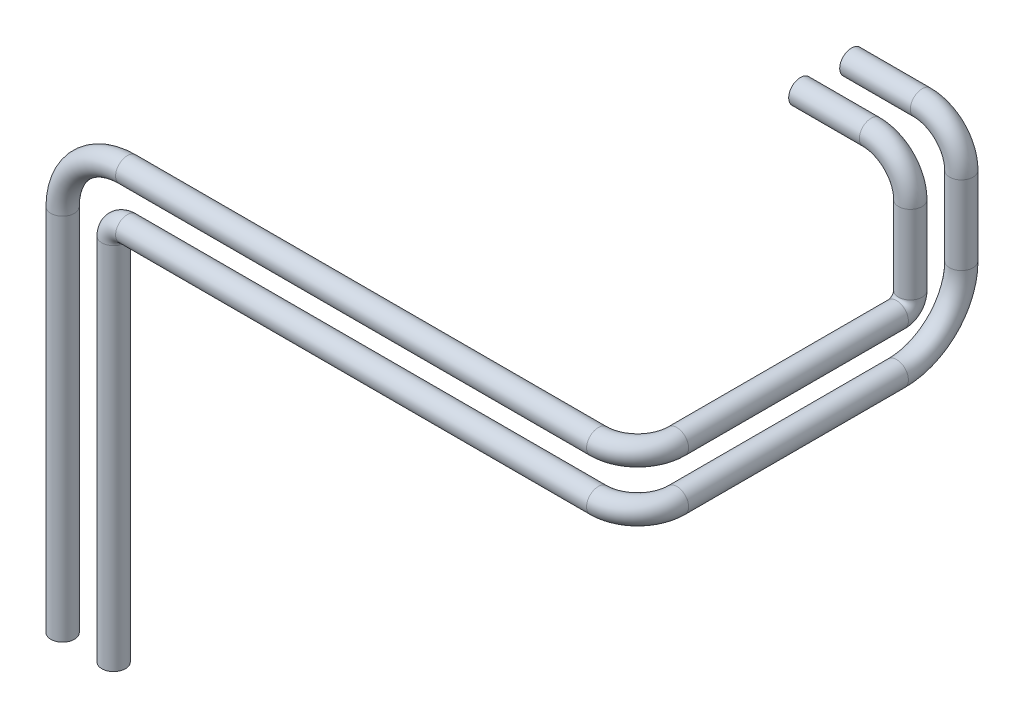
from build123d import *

# Parameters (mm, degrees)
SKETCH5_R = 1.5


with BuildPart() as part:
    # Sweep1: sweep along a curve in space
    with BuildLine() as sweep1_path:
        Line((0, 0, 0), (0, 47, 0))
        ThreePointArc((0, 47, 0), (1.464466094, 50.535533906, 0), (5, 52, 0))
        Line((5, 52, 0), (65, 52, 0))
        ThreePointArc((70, 52, -5), (68.535533906, 52, -1.464466094), (65, 52, 0))
        Line((70, 52, -5), (70, 52, -33))
        ThreePointArc((70, 52, -33), (70, 53.464466094, -36.535533906), (70, 57, -38))
        Line((70, 57, -38), (70, 67, -38))
        ThreePointArc((65, 72, -38), (68.535533906, 70.535533906, -38), (70, 67, -38))
        Line((65, 72, -38), (56, 72, -38))
    # Sketch5 → Sweep1 (sweep)
    with BuildSketch(Plane(origin=(0, 0, 0), x_dir=(1, 0, 0), z_dir=(0, 1, 0))):
        with Locations((-3.25, 0)):
            Circle(SKETCH5_R)
        with Locations((3.25, 0)):
            Circle(SKETCH5_R)
    sweep(path=sweep1_path.line)


solid = part.part
